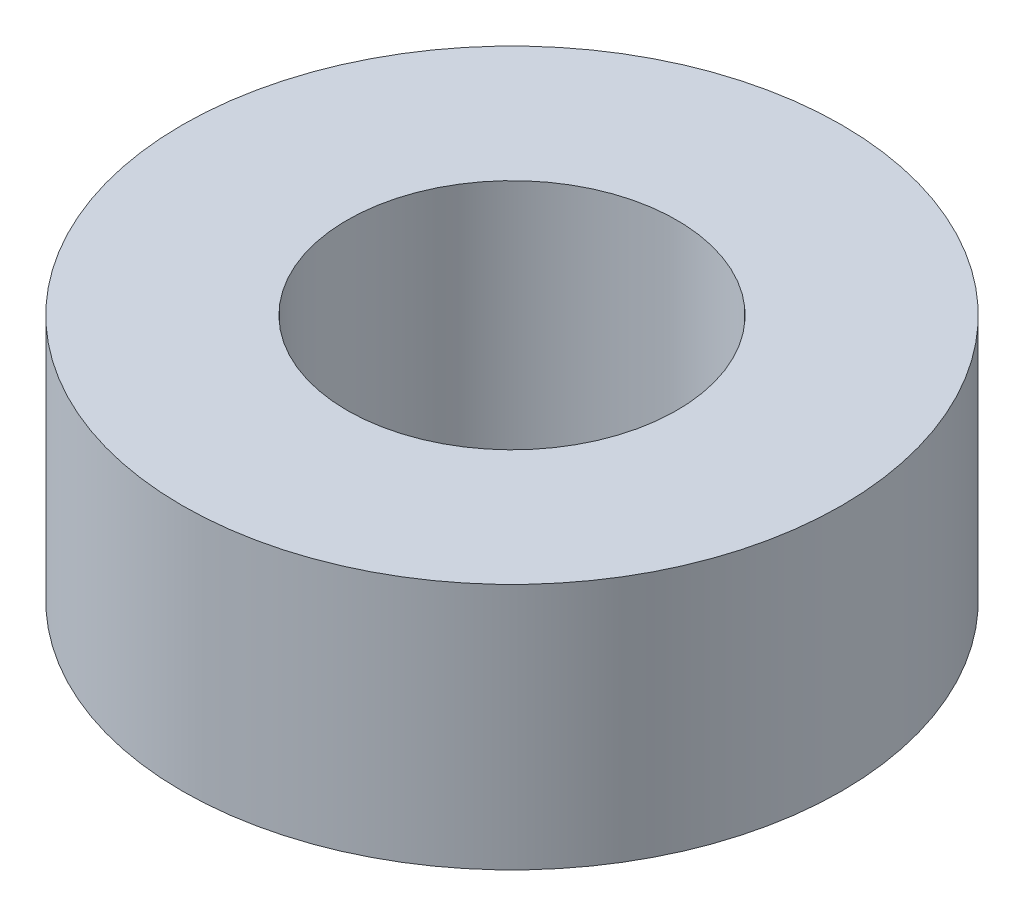
from build123d import *

# Parameters (mm, degrees)
SKETCH1_R           = 4
SKETCH1_R_2         = 2
BOSS_EXTRUDE1_DEPTH = 1.5


with BuildPart() as part:
    # Sketch1 → Boss-Extrude1 (new, symmetric)
    with BuildSketch(Plane(origin=(0, 0, 0), x_dir=(1, 0, 0), z_dir=(0, 1, 0))):
        with Locations(Location((0, 0, 0), (0, 0, 270))):
            Circle(SKETCH1_R)
        with Locations(Location((0, 0, 0), (0, 0, 270))):
            Circle(SKETCH1_R_2, mode=Mode.SUBTRACT)
    extrude(amount=BOSS_EXTRUDE1_DEPTH, both=True)


solid = part.part
